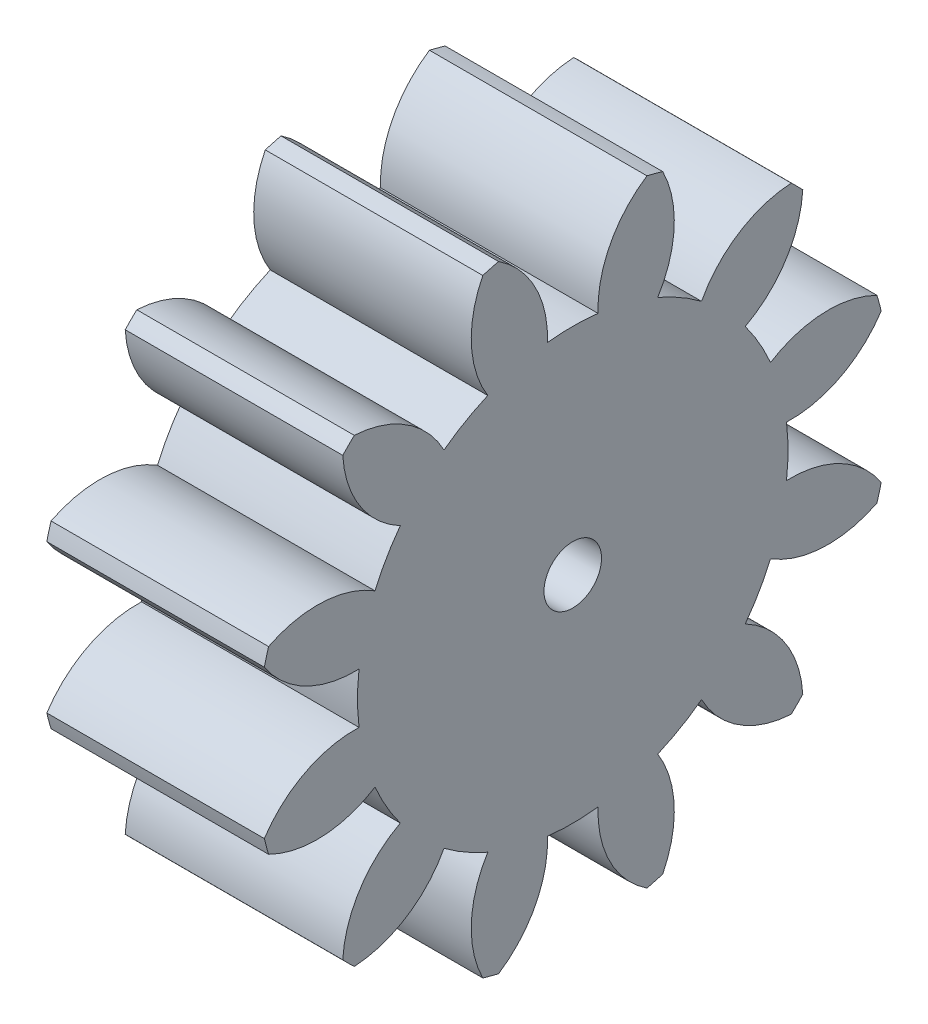
from build123d import *

# Parameters (mm, degrees)
BASPROSKE_W           = 12
BASPROSKE_H           = 17.5
TOOTHCUT_DEPTH        = 28.504545079
TEETHCUTS_COUNT       = 12
TEETHCUTS_ANGLE       = 330
BORSKE_R              = 1.5
BORE_DEPTH            = 50.0000508
CROQUIS1_R            = 1.5875
CORTAR_EXTRUIR1_DEPTH = 27.88866135


with BuildPart() as part:
    # BasProSke → Base-Revolve (revolve)
    with BuildSketch(Plane(origin=(0, 0, 0), x_dir=(1, 0, 0), z_dir=(0, 1, 0)), mode=Mode.PRIVATE) as base_revolve_sk:
        with Locations((6, 8.75)):
            Rectangle(BASPROSKE_W, BASPROSKE_H)
    revolve(base_revolve_sk.sketch.rotate(Axis((-10, 0, 0), (1, 0, 0)), 180), axis=Axis((-10, 0, 0), (1, 0, 0)))

    # TooCutSke → ToothCut (cut, through all)
    with BuildSketch(Plane(origin=(0, 0, 0), x_dir=(0, 0, -1), z_dir=(1, 0, 0))):
        with BuildLine():
            ThreePointArc((1.394381134, 11.791843675), (0, 11.874), (-1.394381134, 11.791843675))
            ThreePointArc((-1.394381134, 11.791843675), (-2.068078374, 14.771857381), (-4.121860996, 17.033787221))
            ThreePointArc((-4.121860996, 17.033787221), (0, 17.5254), (4.121860996, 17.033787221))
            ThreePointArc((4.121860996, 17.033787221), (2.068078374, 14.771857381), (1.394381134, 11.791843675))
        make_face()
    toothcut = extrude(amount=TOOTHCUT_DEPTH, mode=Mode.SUBTRACT)

    # TeethCuts: ToothCut ×12 about axis
    teethcuts_axis = Axis((-10, 0, 0), (1, 0, 0))
    for i in range(1, TEETHCUTS_COUNT):
        add(toothcut.rotate(teethcuts_axis, i * TEETHCUTS_ANGLE / (TEETHCUTS_COUNT - 1)), mode=Mode.SUBTRACT)

    # BorSke → Bore (cut, symmetric)
    with BuildSketch(Plane(origin=(0, 0, 0), x_dir=(0, 0, -1), z_dir=(1, 0, 0))):
        with Locations(Location((0, 0, 0), (0, 0, 180))):
            Circle(BORSKE_R)
    extrude(amount=BORE_DEPTH, both=True, mode=Mode.SUBTRACT)

    # Croquis1 → Cortar-Extruir1 (cut, through all)
    with BuildSketch(Plane.ZY):
        Circle(CROQUIS1_R)
    extrude(amount=-CORTAR_EXTRUIR1_DEPTH, mode=Mode.SUBTRACT)


solid = part.part
